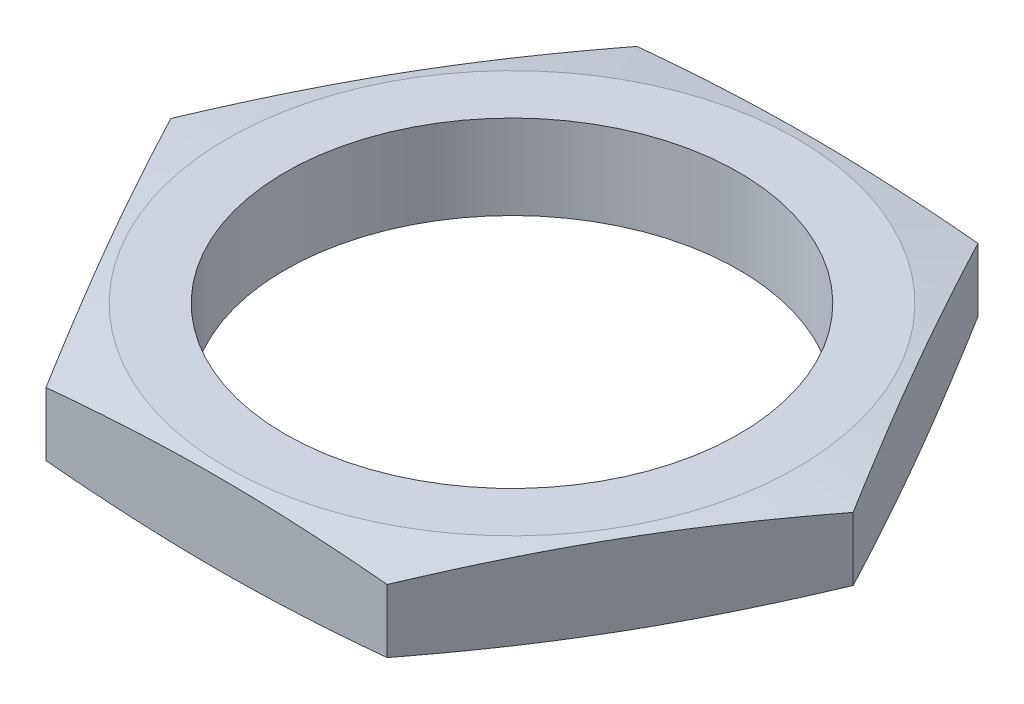
from build123d import *

# Parameters (mm, degrees)
EXTRUDE_1_DEPTH     = 4
SKETCH_2_R          = 10.75
CUT_EXTRUDE_1_DEPTH = 22.756225163


with BuildPart() as part:
    # 草图1 → 凸台-拉伸1 (new body)
    with BuildSketch(Plane(origin=(0, 0, 0), x_dir=(1, 0, 0), z_dir=(0, 1, 0))):
        Polygon((8.082903769, 14), (-8.082903769, 14), (-16.165807537, 0), (-8.082903769, -14), (8.082903769, -14), (16.165807537, 0), align=None)
    extrude(amount=EXTRUDE_1_DEPTH)

    # 草图2 → 切除-拉伸1 (cut, through all)
    with BuildSketch(Plane(origin=(0, 4, 0), x_dir=(1, 0, 0), z_dir=(0, 1, 0))):
        with Locations(Location((0, 0, 0), (0, 0, 270))):
            Circle(SKETCH_2_R)
    extrude(amount=-CUT_EXTRUDE_1_DEPTH, mode=Mode.SUBTRACT)

    # 草图3 → 切除-旋转1 (revolve, cut)
    with BuildSketch(Plane.XY, mode=Mode.PRIVATE) as cut_revolve_1_sk:
        Polygon((-16.165807537, 4), (-16.165807537, 3.5), (-13.5, 4), align=None)
        Polygon((-13.5, 0), (-16.165807537, 0), (-16.165807537, 0.5), align=None)
    revolve(cut_revolve_1_sk.sketch.rotate(Axis((0, 0, 0), (0, 1, 0)), 270), axis=Axis((0, 0, 0), (0, 1, 0)), mode=Mode.SUBTRACT)


solid = part.part
